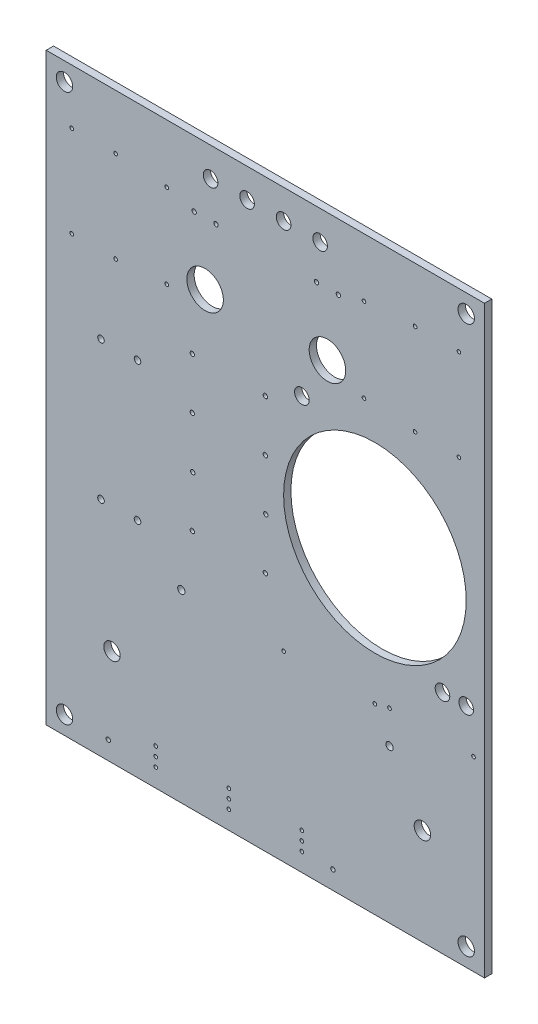
from build123d import *

# Parameters (mm, degrees)
SKETCH_1_W          = 120
SKETCH_1_H          = 160
SKETCH_1_R          = 2.25
SKETCH_1_R_2        = 25
EXTRUDE_1_DEPTH     = 2
SKETCH_2_R          = 2.25
SKETCH_2_R_2        = 0.6
SKETCH_2_R_3        = 0.5
SKETCH_2_R_4        = 2
CUT_EXTRUDE_1_DEPTH = 2
SKETCH_3_R          = 5
SKETCH_3_R_2        = 0.6
SKETCH_3_R_3        = 1
CUT_EXTRUDE_2_DEPTH = 2
SKETCH_4_R          = 0.9
SKETCH_4_R_2        = 0.6
CUT_EXTRUDE_3_DEPTH = 2
SKETCH_5_R          = 0.5
CUT_EXTRUDE_4_DEPTH = 2


with BuildPart() as part:
    # Эскиз1 → Вытянуть1 (new body)
    with BuildSketch(Plane.XY):
        Rectangle(SKETCH_1_W, SKETCH_1_H)
        with Locations((-55, -75)):
            Circle(SKETCH_1_R, mode=Mode.SUBTRACT)
        with Locations((55, -75)):
            Circle(SKETCH_1_R, mode=Mode.SUBTRACT)
        with Locations((55, 75)):
            Circle(SKETCH_1_R, mode=Mode.SUBTRACT)
        with Locations((-55, 75)):
            Circle(SKETCH_1_R, mode=Mode.SUBTRACT)
        with Locations((30, 7)):
            Circle(SKETCH_1_R_2, mode=Mode.SUBTRACT)
    extrude(amount=EXTRUDE_1_DEPTH)

    # Эскиз2 → Вырез-Вытянуть1 (cut)
    with BuildSketch(Plane.XY.offset(2)):
        with Locations((-42, -53.5)):
            Circle(SKETCH_2_R)
        with Locations((43, -53.5)):
            Circle(SKETCH_2_R)
        with Locations((-43, -75)):
            Circle(SKETCH_2_R_2)
        with Locations((18.5, -75)):
            Circle(SKETCH_2_R_2)
        with Locations((-30, -70)):
            Circle(SKETCH_2_R_3)
        with Locations((-30, -72.5)):
            Circle(SKETCH_2_R_3)
        with Locations((-30, -75)):
            Circle(SKETCH_2_R_3)
        with Locations((-10, -70)):
            Circle(SKETCH_2_R_3)
        with Locations((-10, -72.5)):
            Circle(SKETCH_2_R_3)
        with Locations((-10, -75)):
            Circle(SKETCH_2_R_3)
        with Locations((10, -70)):
            Circle(SKETCH_2_R_3)
        with Locations((10, -72.5)):
            Circle(SKETCH_2_R_3)
        with Locations((10, -75)):
            Circle(SKETCH_2_R_3)
        with Locations((-15, 72)):
            Circle(SKETCH_2_R_4)
        with Locations((-5, 72)):
            Circle(SKETCH_2_R_4)
        with Locations((5, 72)):
            Circle(SKETCH_2_R_4)
        with Locations((15, 72)):
            Circle(SKETCH_2_R_4)
        with Locations((10, 33)):
            Circle(SKETCH_2_R_4)
        with Locations((55, -18)):
            Circle(SKETCH_2_R_4)
        with Locations((48.5, -18)):
            Circle(SKETCH_2_R_4)
    extrude(amount=-CUT_EXTRUDE_1_DEPTH, mode=Mode.SUBTRACT)

    # Эскиз3 → Вырез-Вытянуть2 (cut)
    with BuildSketch(Plane.XY.offset(2)):
        with Locations((-16.5, 45)):
            Circle(SKETCH_3_R)
        with Locations((17, 45)):
            Circle(SKETCH_3_R)
        with Locations((-19.5, 62)):
            Circle(SKETCH_3_R_2)
        with Locations((-13.5, 62)):
            Circle(SKETCH_3_R_2)
        with Locations((14, 62)):
            Circle(SKETCH_3_R_2)
        with Locations((20, 62)):
            Circle(SKETCH_3_R_2)
        with Locations((34, -38)):
            Circle(SKETCH_3_R_3)
        with Locations((-23, -29.5)):
            Circle(SKETCH_3_R_3)
    extrude(amount=-CUT_EXTRUDE_2_DEPTH, mode=Mode.SUBTRACT)

    # Эскиз4 → Вырез-Вытянуть3 (cut)
    with BuildSketch(Plane.XY.offset(2)):
        with Locations((-45, 19)):
            Circle(SKETCH_4_R)
        with Locations((-35, 19)):
            Circle(SKETCH_4_R)
        with Locations((-35, -19)):
            Circle(SKETCH_4_R)
        with Locations((-45, -19)):
            Circle(SKETCH_4_R)
        with Locations((-20, -14)):
            Circle(SKETCH_4_R_2)
        with Locations((0, -14)):
            Circle(SKETCH_4_R_2)
        with Locations((-19.873847439, 0)):
            Circle(SKETCH_4_R_2)
        with Locations((0.126152561, 0)):
            Circle(SKETCH_4_R_2)
        with Locations((-20, 14)):
            Circle(SKETCH_4_R_2)
        with Locations((0, 14)):
            Circle(SKETCH_4_R_2)
        with Locations((-20, 28)):
            Circle(SKETCH_4_R_2)
        with Locations((0, 28)):
            Circle(SKETCH_4_R_2)
    extrude(amount=-CUT_EXTRUDE_3_DEPTH, mode=Mode.SUBTRACT)

    # Эскиз5 → Вырез-Вытянуть4 (cut)
    with BuildSketch(Plane.XY.offset(2)):
        with Locations((-53, 40)):
            Circle(SKETCH_5_R)
        with Locations((-53, 65)):
            Circle(SKETCH_5_R)
        with Locations((-41, 40)):
            Circle(SKETCH_5_R)
        with Locations((-41, 65)):
            Circle(SKETCH_5_R)
        with Locations((41, 40)):
            Circle(SKETCH_5_R)
        with Locations((41, 65)):
            Circle(SKETCH_5_R)
        with Locations((53, 40)):
            Circle(SKETCH_5_R)
        with Locations((53, 65)):
            Circle(SKETCH_5_R)
        with Locations((-27, 41)):
            Circle(SKETCH_5_R)
        with Locations((-27, 64)):
            Circle(SKETCH_5_R)
        with Locations((27, 41)):
            Circle(SKETCH_5_R)
        with Locations((27, 64)):
            Circle(SKETCH_5_R)
        with Locations((34, -29)):
            Circle(SKETCH_5_R)
        with Locations((57, -29)):
            Circle(SKETCH_5_R)
        with Locations((5, -30)):
            Circle(SKETCH_5_R)
        with Locations((30, -30)):
            Circle(SKETCH_5_R)
    extrude(amount=-CUT_EXTRUDE_4_DEPTH, mode=Mode.SUBTRACT)


solid = part.part
